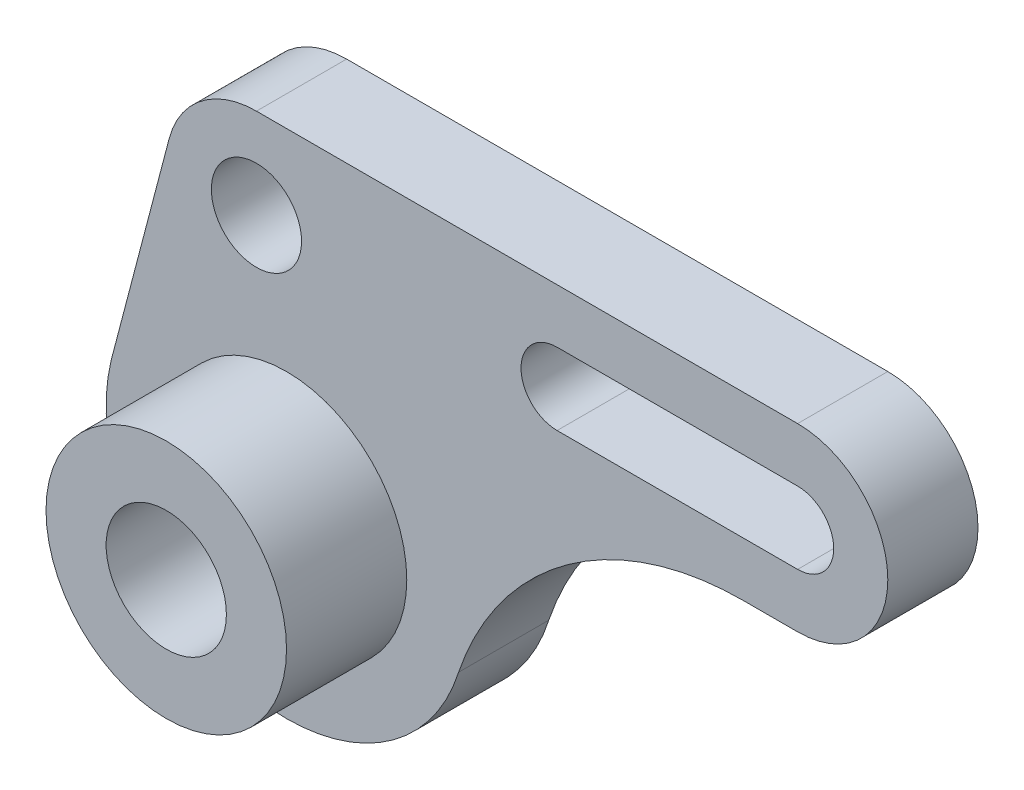
from build123d import *

# Parameters (mm, degrees)
IZIM1_R                     = 20
Y_KSEKLIK_EKSTR_ZYON1_DEPTH = 35
IZIM1_4_R                   = 20
IZIM1_4_R_2                 = 7.5
Y_KSEKLIK_EKSTR_ZYON2_DEPTH = 15
IZIM1_5_R                   = 10
KES_EKSTR_ZYON1_DEPTH       = 35


with BuildPart() as part:
    # Çizim1 → Yükseklik-Ekstrüzyon1 (new body)
    with BuildSketch(Plane.XY):
        with Locations((-29.903991686, 4.831419272)):
            Circle(IZIM1_R)
    extrude(amount=Y_KSEKLIK_EKSTR_ZYON1_DEPTH)

    # Çizim1<4> → Yükseklik-Ekstrüzyon2 (add)
    with BuildSketch(Plane.XY):
        with BuildLine():
            Line((55.096008314, 59.831419272), (7.146594433, 59.831419272))
            Line((7.146594433, 59.831419272), (-34.903991686, 59.831419272))
            ThreePointArc((-34.903991686, 59.831419272), (-44.065545927, 56.70853693), (-49.412372708, 48.640209122))
            Line((-49.412372708, 48.640209122), (-59.079607017, 11.815935722))
            ThreePointArc((-59.079607017, 11.815935722), (-37.906835858, -24.081458226), (-1.28938346, -4.179917815))
            ThreePointArc((-1.28938346, -4.179917815), (16.92570157, 20.448122398), (46.085321375, 29.831419272))
            Line((46.085321375, 29.831419272), (55.096008314, 29.831419272))
            ThreePointArc((55.096008314, 29.831419272), (70.096008314, 44.831419272), (55.096008314, 59.831419272))
        make_face()
        with Locations((-29.903991686, 4.831419272)):
            Circle(IZIM1_4_R, mode=Mode.SUBTRACT)
        with Locations((-34.903991686, 44.831419272)):
            Circle(IZIM1_4_R_2, mode=Mode.SUBTRACT)
        with BuildLine():
            ThreePointArc((15.096008314, 38.831419272), (9.096008314, 44.831419272), (15.096008314, 50.831419272))
            Line((15.096008314, 50.831419272), (55.096008314, 50.831419272))
            ThreePointArc((55.096008314, 50.831419272), (61.096008314, 44.831419272), (55.096008314, 38.831419272))
            Line((55.096008314, 38.831419272), (15.096008314, 38.831419272))
        make_face(mode=Mode.SUBTRACT)
    extrude(amount=Y_KSEKLIK_EKSTR_ZYON2_DEPTH)

    # Çizim1<5> → Kes-Ekstrüzyon1 (cut)
    with BuildSketch(Plane.XY):
        with Locations((-29.903991686, 4.831419272)):
            Circle(IZIM1_5_R)
    extrude(amount=KES_EKSTR_ZYON1_DEPTH, mode=Mode.SUBTRACT)


solid = part.part
